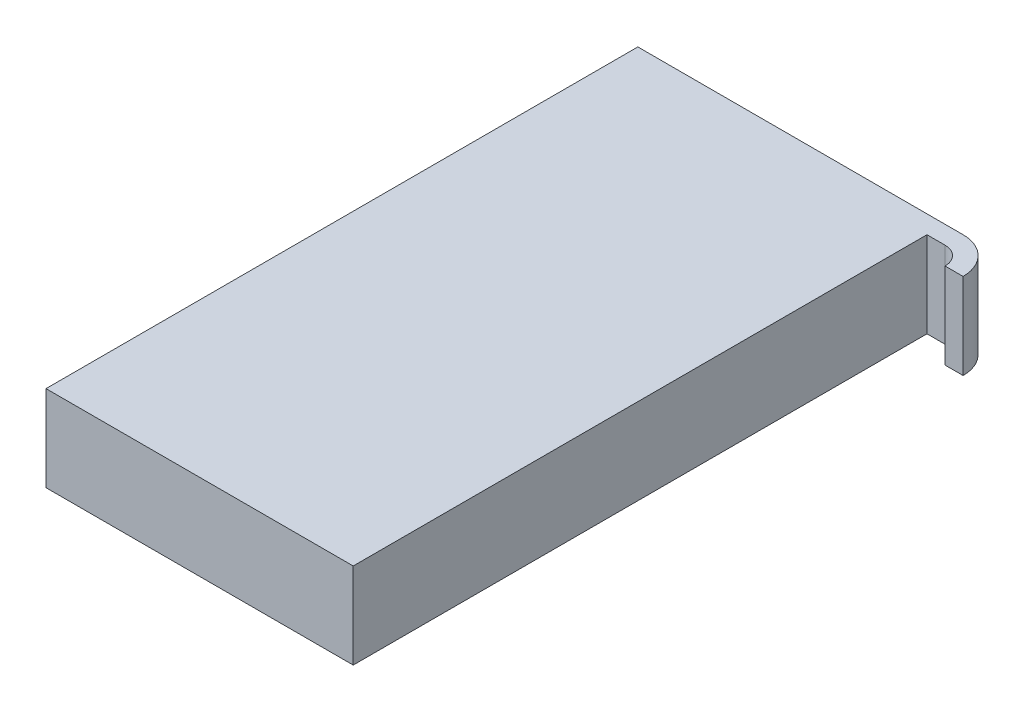
from build123d import *

# Parameters (mm, degrees)
SKETCH1_W           = 34
SKETCH1_H           = 65.5
BOSS_EXTRUDE1_DEPTH = 9.5


with BuildPart() as part:
    # Sketch1 → Boss-Extrude1 (new body)
    with BuildSketch(Plane(origin=(0, 0, 0), x_dir=(1, 0, 0), z_dir=(0, 1, 0))):
        Rectangle(SKETCH1_W, SKETCH1_H)
        with BuildLine():
            Line((19, 32.75), (17, 32.75))
            Line((17, 32.75), (17, 30.75))
            Line((17, 30.75), (19, 30.75))
            ThreePointArc((19, 30.75), (20.414213562, 30.164213562), (21, 28.75))
            Line((21, 28.75), (23, 28.75))
            ThreePointArc((23, 28.75), (21.828427125, 31.578427125), (19, 32.75))
        make_face()
    extrude(amount=BOSS_EXTRUDE1_DEPTH)


solid = part.part
